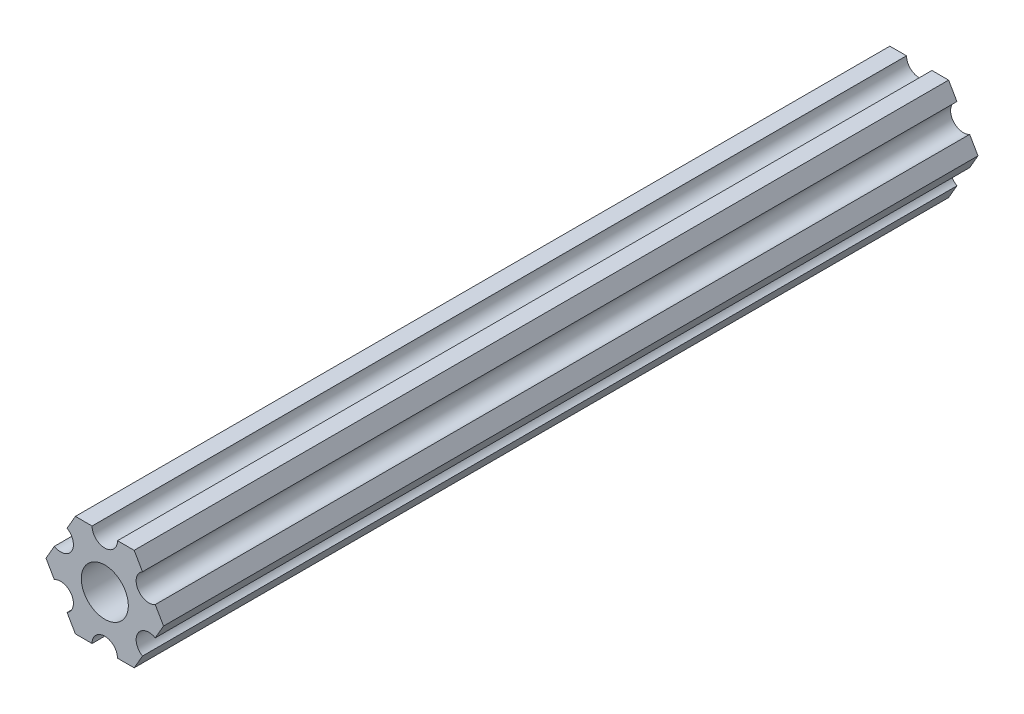
from build123d import *

# Parameters (mm, degrees)
SKETCH1_R           = 2.9337
BOSS_EXTRUDE1_DEPTH = 101.6


with BuildPart() as part:
    # Sketch1 → Boss-Extrude1 (new body)
    with BuildSketch(Plane.XY.offset(304.8)):
        with BuildLine():
            Line((6.293011699, -1.800184894), (7.332348803, -2.22e-07))
            Line((7.332348803, -2.22e-07), (6.293011439, 1.800184522))
            ThreePointArc((6.293011439, 1.800184522), (4.124446058, 2.381249653), (4.705511189, 4.549815034))
            Line((4.705511189, 4.549815034), (3.666173825, 6.349999778))
            Line((3.666173825, 6.349999778), (1.587499615, 6.349999778))
            ThreePointArc((1.587499615, 6.349999778), (-3.85e-07, 4.762499778), (-1.587500385, 6.349999778))
            Line((-1.587500385, 6.349999778), (-3.666174594, 6.349999778))
            Line((-3.666174594, 6.349999778), (-4.70551159, 4.549815043))
            ThreePointArc((-4.70551159, 4.549815043), (-4.12444613, 2.38124975), (-6.293011423, 1.80018429))
            Line((-6.293011423, 1.80018429), (-7.332348419, -4.44e-07))
            Line((-7.332348419, -4.44e-07), (-6.293011205, -1.800185053))
            ThreePointArc((-6.293011205, -1.800185053), (-4.124445841, -2.38125025), (-4.705511038, -4.549815614))
            Line((-4.705511038, -4.549815614), (-3.666173825, -6.350000222))
            Line((-3.666173825, -6.350000222), (-1.587499615, -6.350000222))
            ThreePointArc((-1.587499615, -6.350000222), (3.85e-07, -4.762500222), (1.587500385, -6.350000222))
            Line((1.587500385, -6.350000222), (3.666174594, -6.350000222))
            Line((3.666174594, -6.350000222), (4.705511699, -4.549815551))
            ThreePointArc((4.705511699, -4.549815551), (4.12444637, -2.381250222), (6.293011699, -1.800184894))
        make_face()
        with Locations(Location((0, 0, 0), (0, 0, 180))):
            Circle(SKETCH1_R, mode=Mode.SUBTRACT)
    extrude(amount=-BOSS_EXTRUDE1_DEPTH)


solid = part.part
